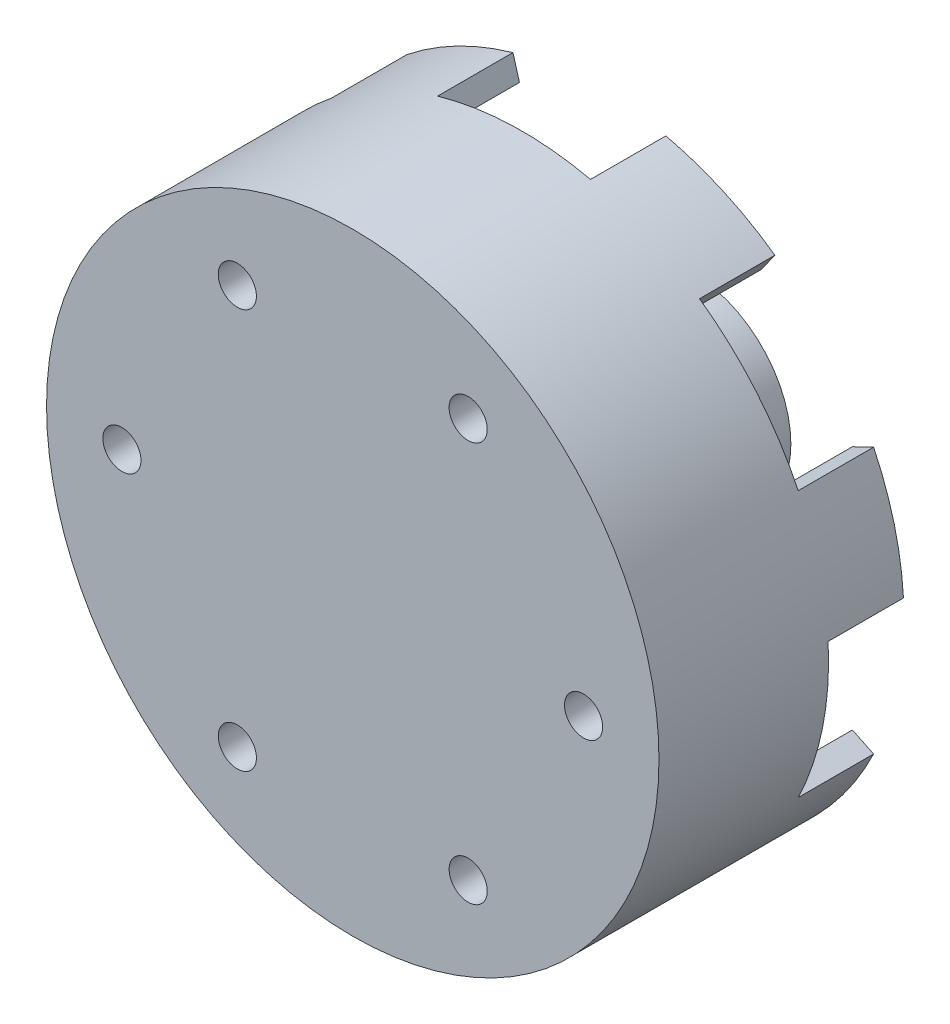
from build123d import *

# Parameters (mm, degrees)
SKETCH1_R           = 10.5
BOSS_EXTRUDE1_DEPTH = 12
SKETCH2_R           = 12
BOSS_EXTRUDE2_DEPTH = 6
SKETCH3_R           = 32.5
BOSS_EXTRUDE3_DEPTH = 18
SKETCH4_R           = 2.025
CUT_EXTRUDE1_DEPTH  = 59.38236035
BOSS_EXTRUDE4_START = 8
BOSS_EXTRUDE4_DEPTH = 8


with BuildPart() as part:
    # Sketch1 → Boss-Extrude1 (new body)
    with BuildSketch(Plane.XY):
        Circle(SKETCH1_R)
    extrude(amount=BOSS_EXTRUDE1_DEPTH)

    # Sketch2 → Boss-Extrude2 (add)
    with BuildSketch(Plane.XY.offset(12)):
        Circle(SKETCH2_R)
    extrude(amount=BOSS_EXTRUDE2_DEPTH)

    # Sketch3 → Boss-Extrude3 (add)
    with BuildSketch(Plane.XY.offset(18)):
        Circle(SKETCH3_R)
    extrude(amount=BOSS_EXTRUDE3_DEPTH)

    # Sketch4 → Cut-Extrude1 (cut, through all)
    with BuildSketch(Plane.XY.offset(36)):
        with Locations((24.5, 0)):
            Circle(SKETCH4_R)
        with Locations((12.25, -21.217622393)):
            Circle(SKETCH4_R)
        with Locations((-12.25, -21.217622393)):
            Circle(SKETCH4_R)
        with Locations((-24.5, 0)):
            Circle(SKETCH4_R)
        with Locations((-12.25, 21.217622393)):
            Circle(SKETCH4_R)
        with Locations((12.25, 21.217622393)):
            Circle(SKETCH4_R)
    extrude(amount=-CUT_EXTRUDE1_DEPTH, mode=Mode.SUBTRACT)

    # Sketch5 → Boss-Extrude4 (add)
    with BuildSketch(Plane(origin=(0, 0, 18), x_dir=(-1, 0, 0), z_dir=(0, 0, -1)).offset(BOSS_EXTRUDE4_START)):
        with BuildLine():
            Line((27.716385975, 11.480502971), (30.026084807, 12.437211552))
            ThreePointArc((30.026084807, 12.437211552), (31.875521613, 6.340435466), (32.5, 0))
            Line((32.5, 0), (30, 0))
            ThreePointArc((30, 0), (29.423558412, 5.85270966), (27.716385975, 11.480502971))
        make_face()
        with BuildLine():
            Line((26.256702657, -14.511566613), (28.444761212, -15.720863831))
            ThreePointArc((28.444761212, -15.720863831), (24.831214714, -20.968089465), (20.26341856, -25.40952318))
            Line((20.26341856, -25.40952318), (18.704694056, -23.454944474))
            ThreePointArc((18.704694056, -23.454944474), (22.921121275, -19.355159506), (26.256702657, -14.511566613))
        make_face()
        with BuildLine():
            Line((5.025186699, -29.576130556), (5.443952257, -32.040808102))
            ThreePointArc((5.443952257, -32.040808102), (-0.911503329, -32.487215357), (-7.231930354, -31.685157146))
            Line((-7.231930354, -31.685157146), (-6.675628019, -29.247837365))
            ThreePointArc((-6.675628019, -29.247837365), (-0.841387688, -29.988198791), (5.025186699, -29.576130556))
        make_face()
        with BuildLine():
            Line((-19.990397339, -22.369264946), (-21.656263783, -24.233370359))
            ThreePointArc((-21.656263783, -24.233370359), (-25.967840774, -19.542805467), (-29.281488207, -14.101221521))
            Line((-29.281488207, -14.101221521), (-27.029066037, -13.016512174))
            ThreePointArc((-27.029066037, -13.016512174), (-23.970314561, -18.039512739), (-19.990397339, -22.369264946))
        make_face()
        with BuildLine():
            Line((-29.952804451, 1.682113417), (-32.448871488, 1.822289535))
            ThreePointArc((-32.448871488, 1.822289535), (-31.469864469, 8.11773554), (-29.281488207, 14.101221521))
            Line((-29.281488207, 14.101221521), (-27.029066037, 13.016512174))
            ThreePointArc((-27.029066037, 13.016512174), (-29.049105664, 7.493294345), (-29.952804451, 1.682113417))
        make_face()
        with BuildLine():
            Line((-17.360138885, 24.466826069), (-18.806817126, 26.505728241))
            ThreePointArc((-18.806817126, 26.505728241), (-13.27443835, 29.665456114), (-7.231930354, 31.685157146))
            Line((-7.231930354, 31.685157146), (-6.675628019, 29.247837365))
            ThreePointArc((-6.675628019, 29.247837365), (-12.253327708, 27.383497952), (-17.360138885, 24.466826069))
        make_face()
        with BuildLine():
            Line((8.305065343, 28.827519658), (8.997154121, 31.229812963))
            ThreePointArc((8.997154121, 31.229812963), (14.916910595, 28.874483169), (20.26341856, 25.40952318))
            Line((20.26341856, 25.40952318), (18.704694056, 23.454944474))
            ThreePointArc((18.704694056, 23.454944474), (13.769455934, 26.653369079), (8.305065343, 28.827519658))
        make_face()
    extrude(amount=-BOSS_EXTRUDE4_DEPTH)


solid = part.part
